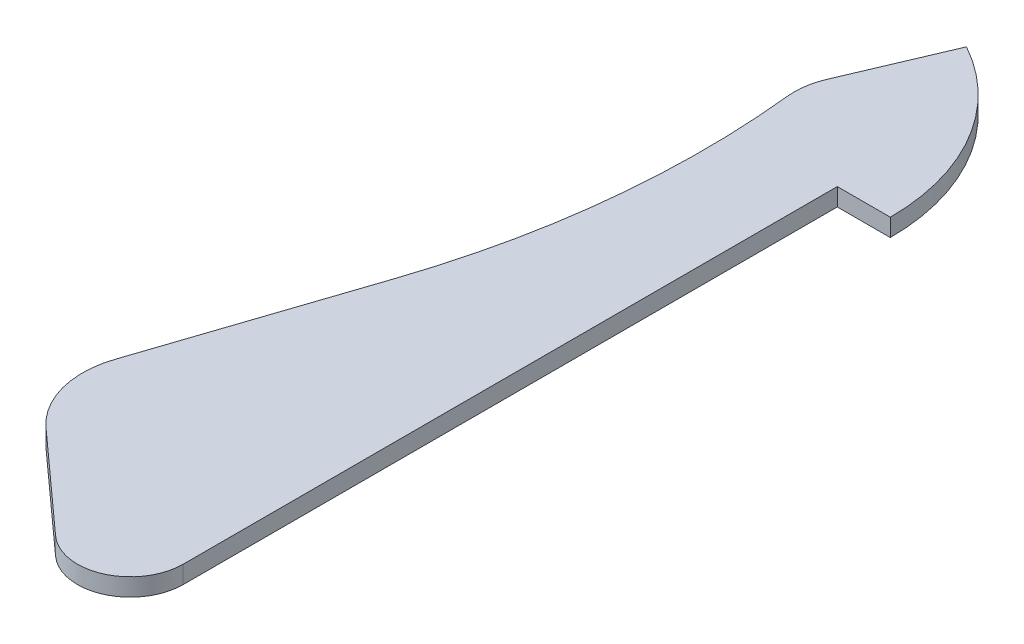
from build123d import *

# Parameters (mm, degrees)
BOSS_EXTRUDE1_DEPTH = 6.35


with BuildPart() as part:
    # Sketch1 → Boss-Extrude1 (new body)
    with BuildSketch(Plane(origin=(0, 0, 0), x_dir=(1, 0, 0), z_dir=(0, 1, 0))):
        with BuildLine():
            Line((0, 0), (0, -234.95))
            ThreePointArc((0, -234.95), (-11.289784316, -252.322290845), (-31.75, -249.061111111))
            Line((-31.75, -249.061111111), (-67.13994853, -217.111852022))
            ThreePointArc((-67.13994853, -217.111852022), (-76.568587152, -201.625781937), (-75.984870047, -183.504610141))
            Line((-75.984870047, -183.504610141), (-50.8, -107.95))
            ThreePointArc((-50.8, -107.95), (-37.112138852, -45.218522559), (-37.04854536, 18.988889479))
            ThreePointArc((-37.04854536, 18.988889479), (-36.913147406, 25.420628086), (-35.166213845, 31.612059039))
            Line((-35.166213845, 31.612059039), (-20.259833627, 66.675))
            ThreePointArc((-20.259833627, 66.675), (8.490957784, 38.700189421), (19.05, 0))
            Line((19.05, 0), (0, 0))
        make_face()
    extrude(amount=BOSS_EXTRUDE1_DEPTH)


solid = part.part
